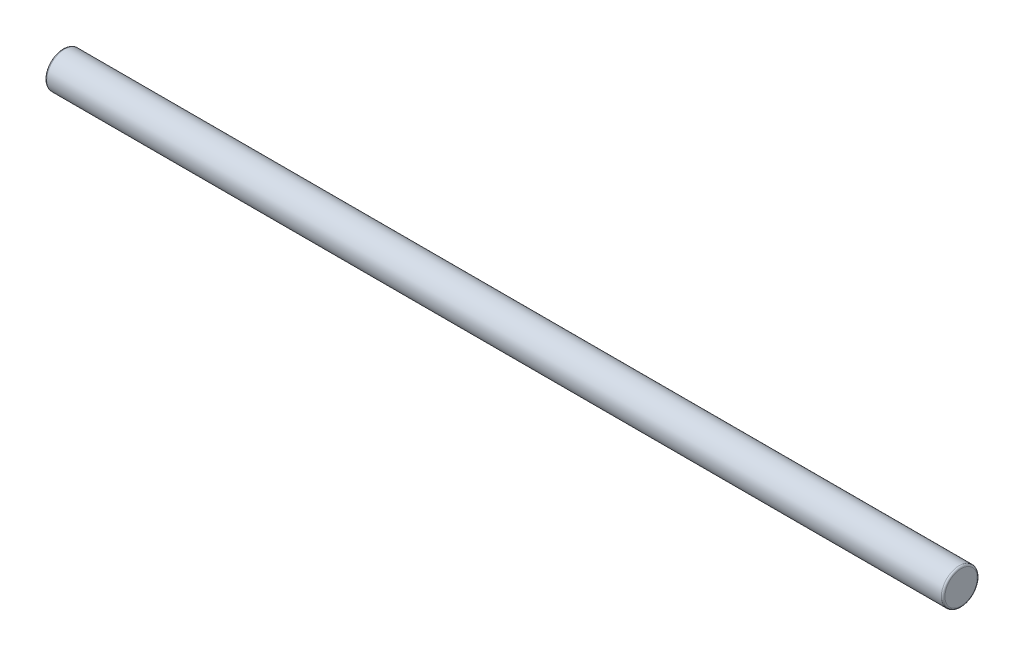
from build123d import *

# Parameters (mm, degrees)
CROQUIS1_R              = 10
SALIENTE_EXTRUIR1_DEPTH = 250
REDONDEO1_R             = 1


with BuildPart() as part:
    # Croquis1 → Saliente-Extruir1 (new, symmetric)
    with BuildSketch(Plane(origin=(0, 0, 0), x_dir=(0, 0, -1), z_dir=(1, 0, 0))):
        Circle(CROQUIS1_R)
    extrude(amount=SALIENTE_EXTRUIR1_DEPTH, both=True)

    # Redondeo1
    redondeo1_edges = [part.edges().sort_by_distance(p)[0] for p in [
        (-250, 0, 10),
        (250, 0, 10),
    ]]
    fillet(redondeo1_edges, radius=REDONDEO1_R)


solid = part.part
